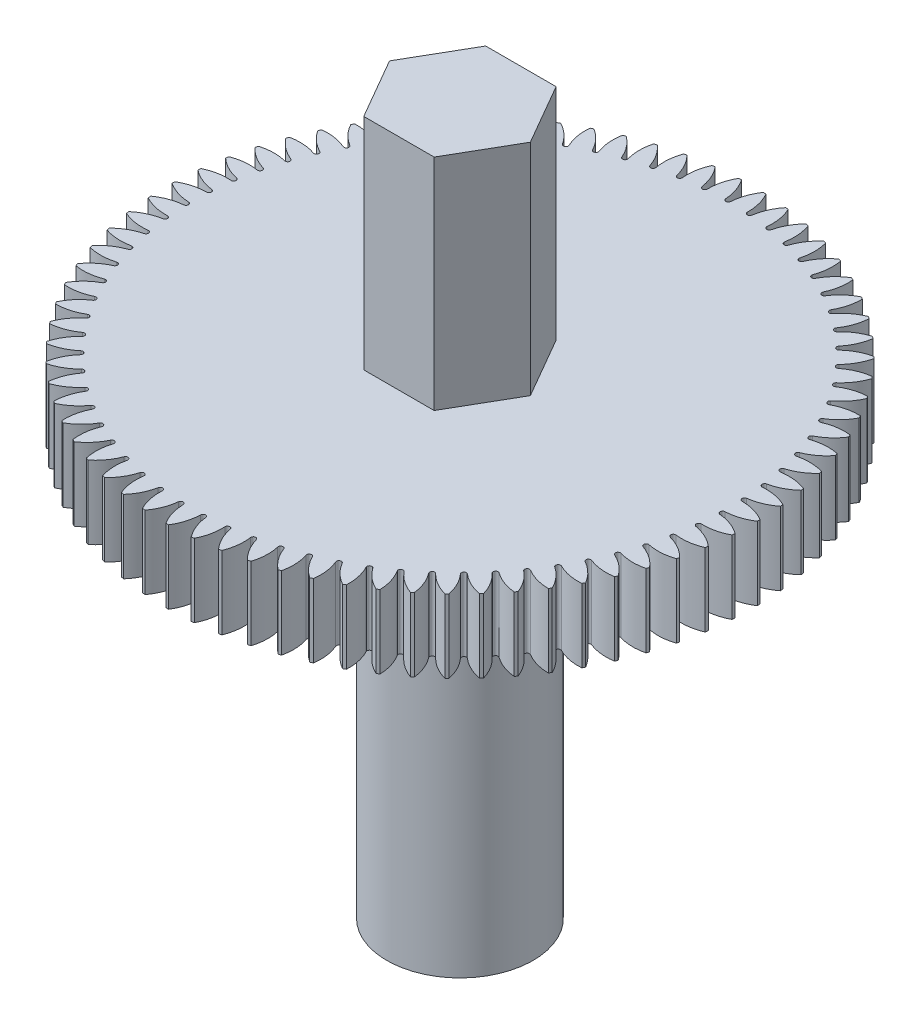
from build123d import *

# Parameters (mm, degrees)
CUT_EXTRUDE1_DEPTH = 10
CIRPATTERN1_COUNT  = 75
CUT_EXTRUDE2_START = -9
SKETCH4_R          = 3
CUT_EXTRUDE2_DEPTH = 9


with BuildPart() as part:
    # Sketch2 → Revolve1 (revolve)
    with BuildSketch(Plane.XY, mode=Mode.PRIVATE) as revolve1_sk:
        Polygon((0, 0), (0, 29), (3, 29), (3, 20), (12, 20), (12, 17), (3, 17), (3, 0), align=None)
    revolve(revolve1_sk.sketch.rotate(Axis((0, 0, 0), (0, 1, 0)), 90), axis=Axis((0, 0, 0), (0, 1, 0)))

    # Sketch3 → Cut-Extrude1 (cut)
    with BuildSketch(Plane(origin=(0, 20, 0), x_dir=(1, 0, 0), z_dir=(0, 1, 0))):
        with BuildLine():
            Line((-0.45, 12), (0.45, 12))
            ThreePointArc((0.45, 12), (0.20662013, 11.520499796), (0.099787768, 10.993488362))
            ThreePointArc((0.099787768, 10.993488362), (0, 10.9), (-0.099787768, 10.993488362))
            ThreePointArc((-0.099787768, 10.993488362), (-0.20662013, 11.520499796), (-0.45, 12))
        make_face()
    cut_extrude1 = extrude(amount=-CUT_EXTRUDE1_DEPTH, mode=Mode.SUBTRACT)

    # CirPattern1: Cut-Extrude1 ×75 about axis
    cirpattern1_axis = Axis((0, 0, 0), (0, 1, 0))
    for i in range(1, CIRPATTERN1_COUNT):
        add(cut_extrude1.rotate(cirpattern1_axis, i * 360 / CIRPATTERN1_COUNT), mode=Mode.SUBTRACT)

    # Sketch4 → Cut-Extrude2 (cut)
    with BuildSketch(Plane(origin=(0, 29, 0), x_dir=(1, 0, 0), z_dir=(0, 1, 0)).offset(CUT_EXTRUDE2_START)):
        with Locations(Location((0, 0, 0), (0, 0, 90))):
            Circle(SKETCH4_R)
        Polygon((-1.443375673, -2.5), (1.443375673, -2.5), (2.886751346, 0), (1.443375673, 2.5), (-1.443375673, 2.5), (-2.886751346, 0), align=None, mode=Mode.SUBTRACT)
    extrude(amount=CUT_EXTRUDE2_DEPTH, mode=Mode.SUBTRACT)


solid = part.part
